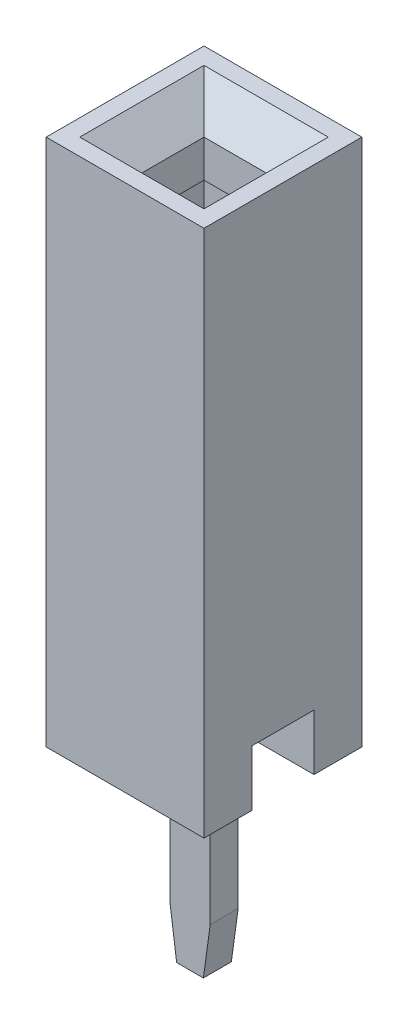
from build123d import *

# Parameters (mm, degrees)
SKETCH1_W               = 2.54
SKETCH1_H               = 2.54
BOSS_EXTRUDE1_DEPTH     = 8.5
SHELL1_T                = -0.77
CHAMFER1_SIZE           = 0.5
CUT_EXTRUDE1_DEPTH      = 9.687680933
CUT_EXTRUDE1_DEPTH_BACK = 9.687680933
SKETCH2_W               = 1
SKETCH2_H               = 0.9
CUT_EXTRUDE3_START      = 1.4
SKETCH3_W               = 2
SKETCH3_H               = 2
CUT_EXTRUDE3_DEPTH      = 6
BOSS_EXTRUDE2_DEPTH     = 0.225


with BuildPart() as part:
    # Sketch1 → Boss-Extrude1 (new body)
    with BuildSketch(Plane(origin=(0, 0, 0), x_dir=(1, 0, 0), z_dir=(0, 1, 0))):
        Rectangle(SKETCH1_W, SKETCH1_H)
    extrude(amount=BOSS_EXTRUDE1_DEPTH)

    # Shell1
    shell1_openings = [part.faces().sort_by_distance(p)[0] for p in [
        (0, 8.5, 0),
    ]]
    offset(amount=SHELL1_T, openings=shell1_openings, kind=Kind.INTERSECTION)

    # Chamfer1
    chamfer1_edges = [part.edges().sort_by_distance(p)[0] for p in [
        (-0.5, 8.5, 0),
        (0, 8.5, 0.5),
        (0.5, 8.5, 0),
        (0, 8.5, -0.5),
    ]]
    chamfer(chamfer1_edges, length=CHAMFER1_SIZE)

    # Sketch2 → Cut-Extrude1 (cut, two sides: drawn at the far end of the back side and taken through both)
    with BuildSketch(Plane(origin=(0, 0, 0), x_dir=(0, 0, -1), z_dir=(1, 0, 0)).offset(-CUT_EXTRUDE1_DEPTH_BACK)):
        with Locations((0, 0.45)):
            Rectangle(SKETCH2_W, SKETCH2_H)
    extrude(amount=CUT_EXTRUDE1_DEPTH + CUT_EXTRUDE1_DEPTH_BACK, mode=Mode.SUBTRACT)

    # Sketch3 → Cut-Extrude3 (cut)
    with BuildSketch(Plane(origin=(0, 0, 0), x_dir=(1, 0, 0), z_dir=(0, 1, 0)).offset(CUT_EXTRUDE3_START)):
        Rectangle(SKETCH3_W, SKETCH3_H)
    extrude(amount=CUT_EXTRUDE3_DEPTH, mode=Mode.SUBTRACT)

    # Sketch4 → Boss-Extrude2 (add, symmetric)
    with BuildSketch(Plane.XY):
        with BuildLine():
            Line((-1, 7.3), (-1, 1.4))
            Line((-1, 1.4), (-0.325, 1.4))
            Line((-0.325, 1.4), (-0.325, -2.2))
            Line((-0.325, -2.2), (-0.215, -3))
            Line((-0.215, -3), (0.215, -3))
            Line((0.215, -3), (0.325, -2.2))
            Line((0.325, -2.2), (0.325, 1.4))
            Line((0.325, 1.4), (1, 1.4))
            Line((1, 1.4), (1, 7.3))
            ThreePointArc((1, 7.3), (0.931110636, 7.382586314), (0.837506501, 7.329628693))
            Line((0.837506501, 7.329628693), (0.6, 6.7))
            ThreePointArc((0.6, 6.7), (0.435896058, 5.8), (0.6, 4.9))
            Line((0.6, 4.9), (0.6, 2.8))
            ThreePointArc((0.6, 2.8), (0, 2.2), (-0.6, 2.8))
            Line((-0.6, 2.8), (-0.6, 4.9))
            ThreePointArc((-0.6, 4.9), (-0.435896058, 5.8), (-0.6, 6.7))
            Line((-0.6, 6.7), (-0.837506501, 7.329628693))
            ThreePointArc((-0.837506501, 7.329628693), (-0.931110636, 7.382586314), (-1, 7.3))
        make_face()
    extrude(amount=BOSS_EXTRUDE2_DEPTH, both=True)


solid = part.part
